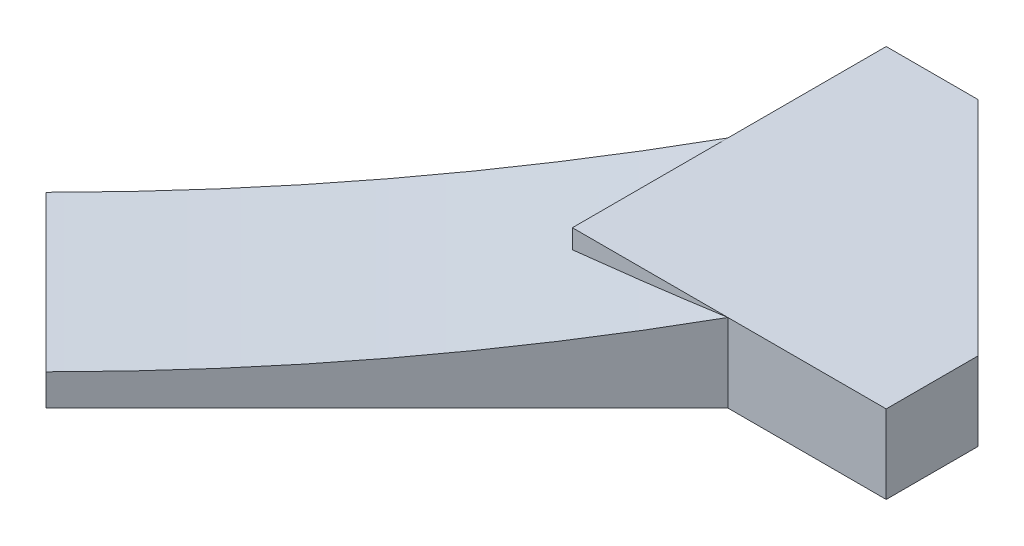
from build123d import *

# Parameters (mm, degrees)
EXTRUDE_1_DEPTH     = 5
CUT_EXTRUDE_1_DEPTH = 20
EXTRUDE_2_DEPTH     = 5


with BuildPart() as part:
    # 草图1 → 凸台-拉伸1 (new body)
    with BuildSketch(Plane(origin=(0, 0, 0), x_dir=(1, 0, 0), z_dir=(0, 1, 0))):
        Polygon((0, 20), (5.85, 20), (20, 5.85), (20, 0), (14.15, 0), (9.907359313, 0), (-11.819805153, -21.727164466), (-21.727164466, -11.819805153), (0, 9.907359313), align=None)
    extrude(amount=EXTRUDE_1_DEPTH)

    # 草图2 → 切除-拉伸1 (cut)
    with BuildSketch(Plane(origin=(4.953679656, 0, 4.953679656), x_dir=(0.7071067811865477, 0, -0.7071067811865475), z_dir=(0.7071067811865475, 0, 0.7071067811865477))):
        with BuildLine():
            Line((-23.721289706, 2), (-23.721289706, 5))
            Line((-23.721289706, 5), (7.005560954, 5))
            ThreePointArc((7.005560954, 5), (-8.284812198, 2.751778874), (-23.721289706, 2))
        make_face()
    extrude(amount=-CUT_EXTRUDE_1_DEPTH, mode=Mode.SUBTRACT)

    # 草图3 → 凸台-拉伸2 (add)
    with BuildSketch(Plane(origin=(0, 5, 0), x_dir=(1, 0, 0), z_dir=(0, 1, 0))):
        Polygon((0, 9.907359313), (0, 0), (9.907359313, 0), align=None)
    extrude(amount=-EXTRUDE_2_DEPTH)


solid = part.part
